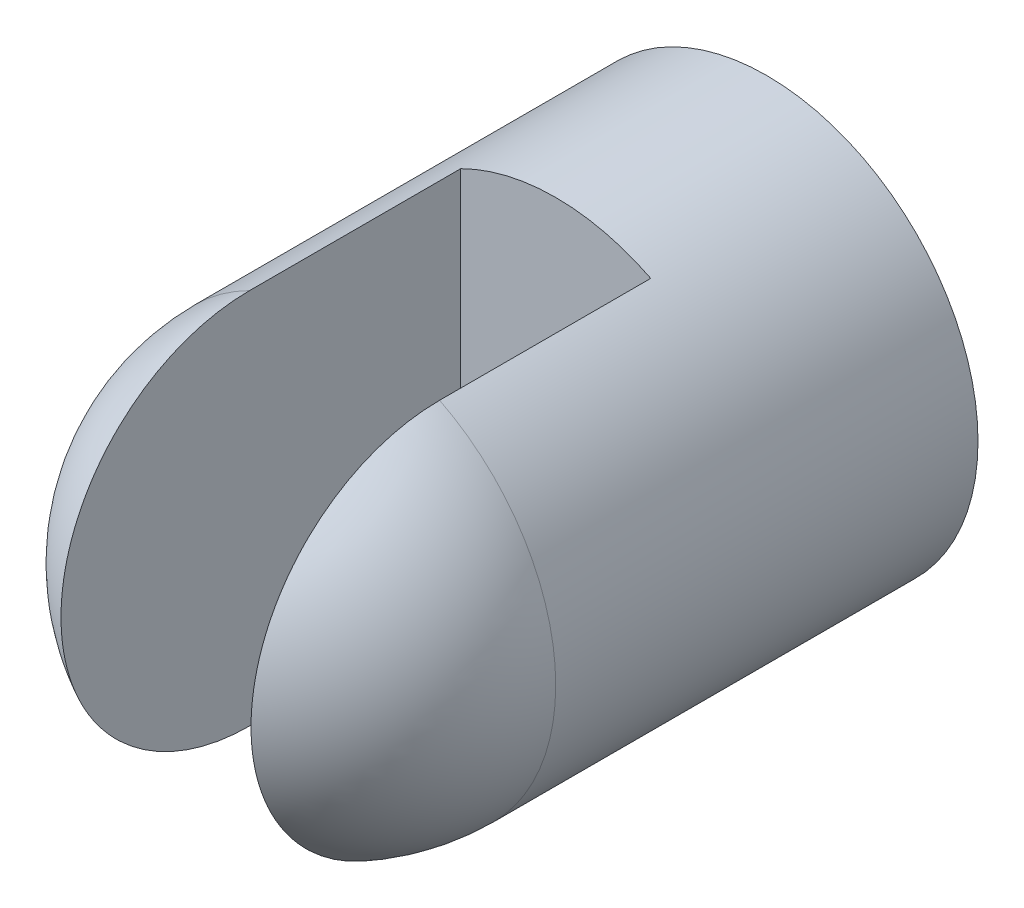
from build123d import *

# Parameters (mm, degrees)
SKETCH1_R           = 100
BOSS_EXTRUDE2_DEPTH = 200
DOME1_FACE_RADIUS   = 100
DOME1_HEIGHT        = 100
SKETCH3_W           = 90
SKETCH3_H           = 221.081096798
CUT_EXTRUDE1_DEPTH  = 200
SKETCH4_R           = 40
BOSS_EXTRUDE3_DEPTH = 5


with BuildPart() as part:
    # Sketch1 → Boss-Extrude2 (new body)
    with BuildSketch(Plane.XY):
        Circle(SKETCH1_R)
    extrude(amount=BOSS_EXTRUDE2_DEPTH)

    # Dome1: a dome of height H over a round flat face of radius A is a cap of a sphere of radius (A * A + H * H) / (2 * H)
    dome1_r = (DOME1_FACE_RADIUS * DOME1_FACE_RADIUS + DOME1_HEIGHT * DOME1_HEIGHT) / (2 * DOME1_HEIGHT)
    dome1_base = Plane((0, 0, 200), z_dir=(0, 0, 1))
    with Locations(dome1_base.offset(DOME1_HEIGHT - dome1_r)):
        dome1_ball = Sphere(dome1_r, mode=Mode.PRIVATE)
    add(split(dome1_ball, bisect_by=dome1_base, keep=Keep.TOP, mode=Mode.PRIVATE))

    # Sketch3 → Cut-Extrude1 (cut)
    with BuildSketch(Plane.XY.offset(300)):
        Rectangle(SKETCH3_W, SKETCH3_H)
    extrude(amount=-CUT_EXTRUDE1_DEPTH, mode=Mode.SUBTRACT)

    # Sketch4 → Boss-Extrude3 (add)
    with BuildSketch(Plane(origin=(0, 0, 0), x_dir=(-1, 0, 0), z_dir=(0, 0, -1))):
        Circle(SKETCH4_R)
    extrude(amount=BOSS_EXTRUDE3_DEPTH)


solid = part.part
